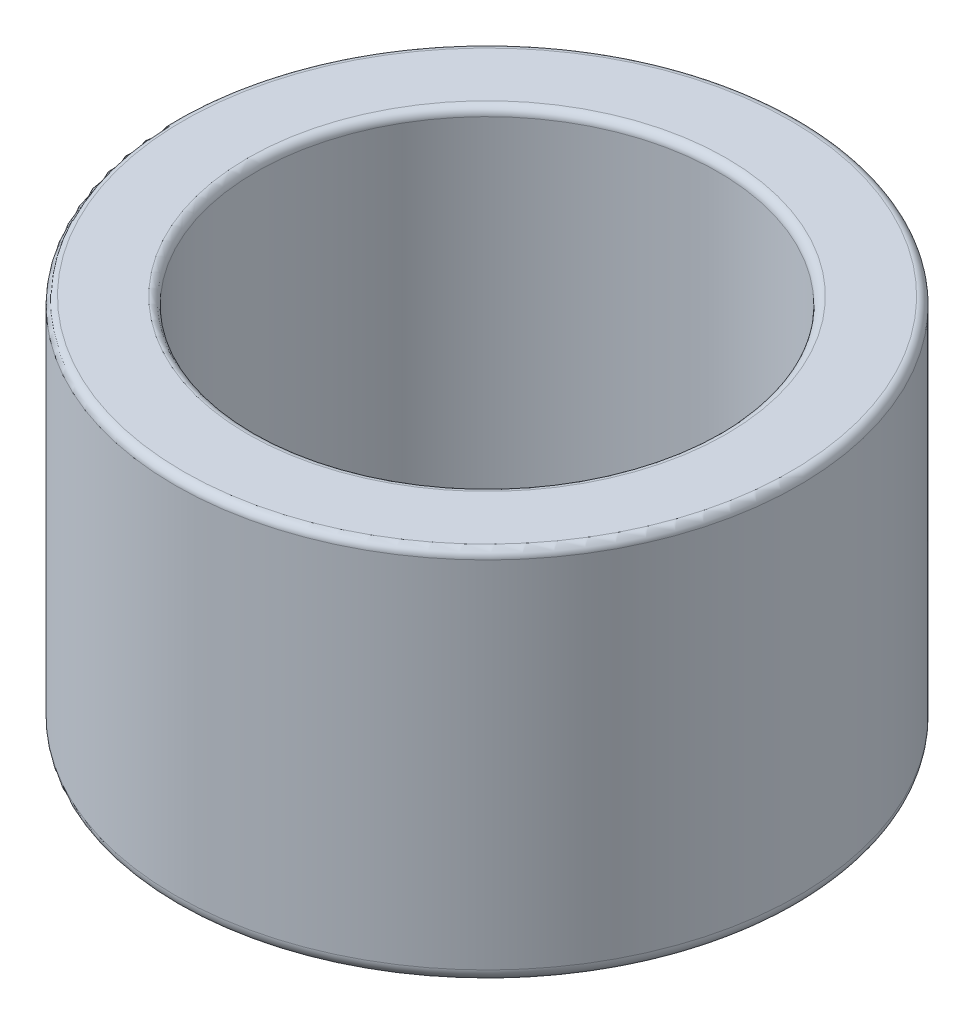
from build123d import *

# Parameters (mm, degrees)
SKETCH1_R           = 11.59435
SKETCH1_R_2         = 8.59435
BOSS_EXTRUDE1_DEPTH = 14
FILLET1_R           = 0.3
FILLET5_R           = 0.3
FILLET6_R           = 0.5
FILLET7_R           = 0.5


with BuildPart() as part:
    # Sketch1 → Boss-Extrude1 (new body)
    with BuildSketch(Plane(origin=(0, 0, 0), x_dir=(1, 0, 0), z_dir=(0, 1, 0))):
        with Locations(Location((0, 0, 0), (0, 0, 270))):
            Circle(SKETCH1_R)
        with Locations(Location((0, 0, 0), (0, 0, 270))):
            Circle(SKETCH1_R_2, mode=Mode.SUBTRACT)
    extrude(amount=BOSS_EXTRUDE1_DEPTH)

    # Fillet1
    fillet1_edges = [part.edges().sort_by_distance(p)[0] for p in [
        (0, 14, -11.59435),
    ]]
    fillet(fillet1_edges, radius=FILLET1_R)

    # Fillet5
    fillet5_edges = [part.edges().sort_by_distance(p)[0] for p in [
        (0, 14, -8.59435),
    ]]
    fillet(fillet5_edges, radius=FILLET5_R)

    # Fillet6
    fillet6_edges = [part.edges().sort_by_distance(p)[0] for p in [
        (0, 0, -11.59435),
    ]]
    fillet(fillet6_edges, radius=FILLET6_R)

    # Fillet7
    fillet7_edges = [part.edges().sort_by_distance(p)[0] for p in [
        (0, 0, -8.59435),
    ]]
    fillet(fillet7_edges, radius=FILLET7_R)


solid = part.part
